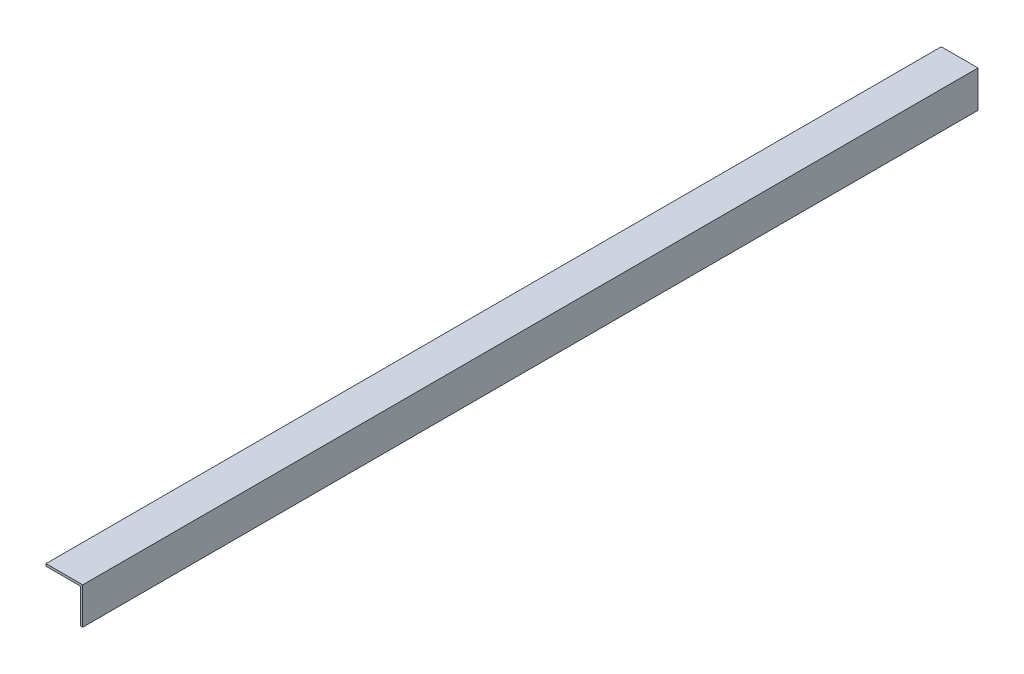
from build123d import *

# Parameters (mm, degrees)
PRESS_TEPSI_RAFI_KOSEBENT_SAG_1_START = -20
PRESS_TEPSI_RAFI_KOSEBENT_SAG_1_DEPTH = 780


with BuildPart() as part:
    # Sketch1 → PRESS_tepsi_rafi_kosebent_sag_1 (new body)
    with BuildSketch(Plane.XY.offset(PRESS_TEPSI_RAFI_KOSEBENT_SAG_1_START)):
        Polygon((662, 1042), (660, 1042), (660, 1072), (630, 1072), (630, 1074), (662, 1074), align=None)
    extrude(amount=-PRESS_TEPSI_RAFI_KOSEBENT_SAG_1_DEPTH)


solid = part.part
